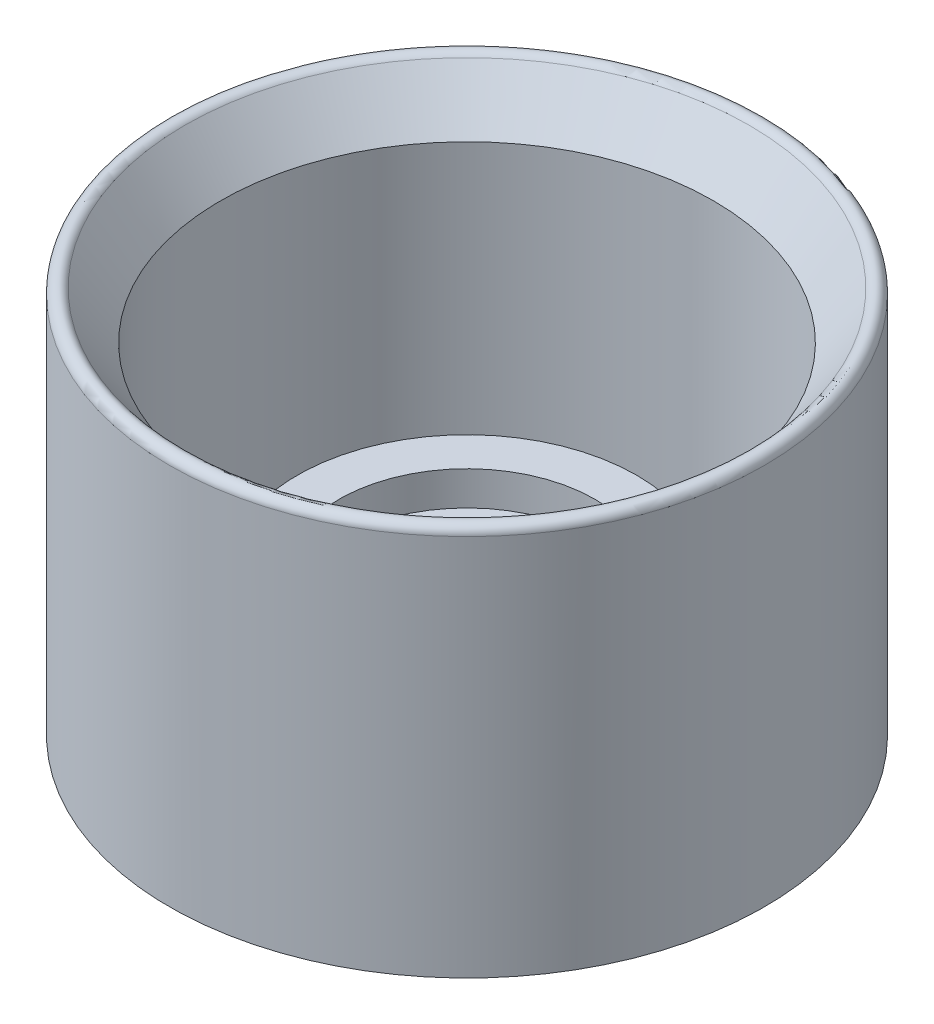
from build123d import *

# Parameters (mm, degrees)
FILLET_1_R = 0.5


with BuildPart() as part:
    # Эскиз1 → Повернуть1 (revolve)
    with BuildSketch(Plane(origin=(0, 0, 0), x_dir=(0, 0, -1), z_dir=(1, 0, 0))):
        Polygon((1.5, 0), (17.5, 0), (17.5, 24), (14.5, 20), (14.5, 1.5), (11.5, 1.5), (11.5, 3.25), (10, 3.25), (10, 8.25), (7.55, 8.25), (7.55, 6.25), (1.5, 6.25), align=None)
    revolve(axis=Axis((0, 0, 0), (0, 1, 0)))

    # Скругление1
    fillet_1_edges = [part.edges().sort_by_distance(p)[0] for p in [
        (0, 24, 17.5),
    ]]
    fillet(fillet_1_edges, radius=FILLET_1_R)


solid = part.part
